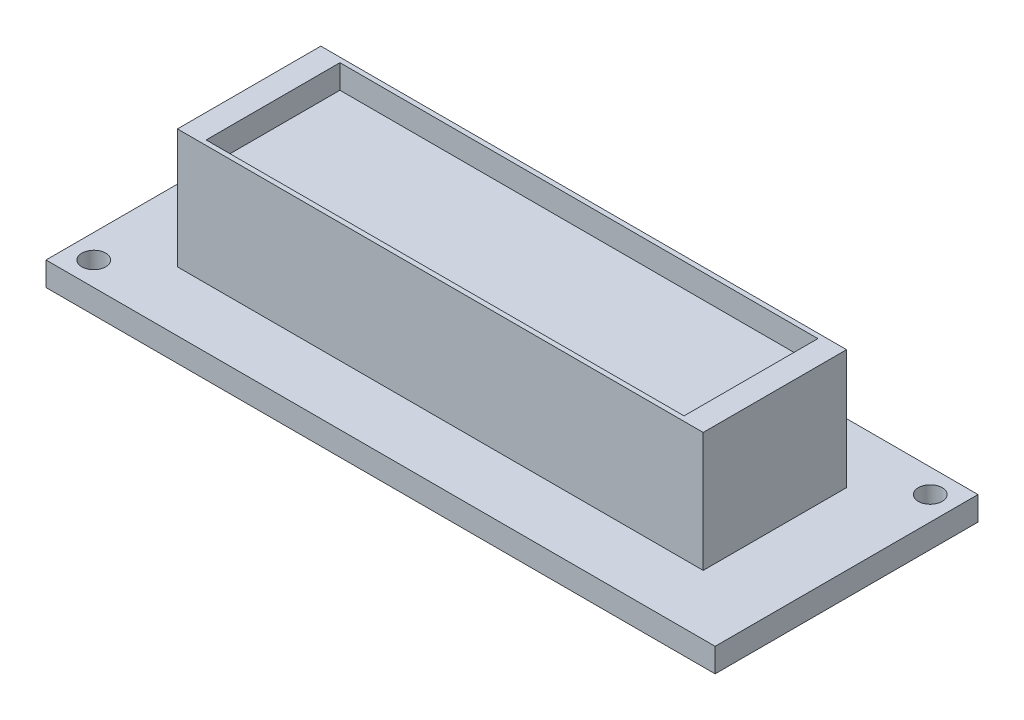
from build123d import *

# Parameters (mm, degrees)
SKETCH1_W           = 100
SKETCH1_H           = 28
BOSS_EXTRUDE1_DEPTH = 1
BOSS_EXTRUDE2_DEPTH = 30
BOSS_EXTRUDE3_DEPTH = 5
SKETCH4_W           = 140
SKETCH4_H           = 55
SKETCH4_W_2         = 120
SKETCH4_H_2         = 35
SKETCH4_W_3         = 110
SKETCH4_H_3         = 30
BOSS_EXTRUDE4_DEPTH = 5
SKETCH5_W           = 100
SKETCH5_H           = 28
BOSS_EXTRUDE5_DEPTH = 25
SKETCH6_R           = 2.5
CUT_EXTRUDE1_DEPTH  = 25


with BuildPart() as part:
    # Sketch1 → Boss-Extrude1 (new body)
    with BuildSketch(Plane(origin=(0, 0, 0), x_dir=(1, 0, 0), z_dir=(0, 1, 0))):
        with Locations((50, 14)):
            Rectangle(SKETCH1_W, SKETCH1_H)
    extrude(amount=BOSS_EXTRUDE1_DEPTH)



with BuildPart() as body_2:
    # Sketch2 → Boss-Extrude2 (new body)
    with BuildSketch(Plane(origin=(0, 1, 0), x_dir=(1, 0, 0), z_dir=(0, 1, 0))):
        Polygon((105, -1), (105, 14), (105, 29), (-5, 29), (-5, -1), align=None)
        Polygon((100, 28), (100, 14), (100, 0), (0, 0), (0, 28), align=None, mode=Mode.SUBTRACT)
    extrude(amount=BOSS_EXTRUDE2_DEPTH)

    # Sketch3 → Boss-Extrude3 (add)
    with BuildSketch(Plane.XZ.offset(-1)):
        Polygon((50, 3.5), (50, 1), (105, 1), (105, -29), (50, -29), (50, -31.5), (110, -31.5), (110, 3.5), align=None)
        Polygon((-5, 1), (50, 1), (50, 3.5), (-10, 3.5), (-10, -31.5), (50, -31.5), (50, -29), (-5, -29), align=None)
    extrude(amount=-BOSS_EXTRUDE3_DEPTH)

    # Sketch4 → Boss-Extrude4 (add)
    # profile 1 of 2: a face of its own
    with BuildSketch(Plane(origin=(0, 6, 0), x_dir=(1, 0, 0), z_dir=(0, 1, 0))):
        with Locations((50, 14)):
            Rectangle(SKETCH4_W, SKETCH4_H)
        with Locations((50, 14)):
            Rectangle(SKETCH4_W_2, SKETCH4_H_2, mode=Mode.SUBTRACT)
    # profile 2 of 2: a face of its own
    with BuildSketch(Plane(origin=(0, 6, 0), x_dir=(1, 0, 0), z_dir=(0, 1, 0))):
        with Locations((50, 14)):
            Rectangle(SKETCH4_W_2, SKETCH4_H_2)
        with Locations((50, 14)):
            Rectangle(SKETCH4_W_3, SKETCH4_H_3, mode=Mode.SUBTRACT)
    extrude(amount=-BOSS_EXTRUDE4_DEPTH)


with BuildPart() as part_1:
    add(part.part)

    add(body_2.part)  # Boss-Extrude5 merges body 2
    # Sketch5 → Boss-Extrude5 (add)
    with BuildSketch(Plane(origin=(0, 1, 0), x_dir=(1, 0, 0), z_dir=(0, 1, 0))):
        with Locations((50, 14)):
            Rectangle(SKETCH5_W, SKETCH5_H)
    extrude(amount=BOSS_EXTRUDE5_DEPTH)

    # Sketch6 → Cut-Extrude1 (cut)
    with BuildSketch(Plane(origin=(0, 6, 0), x_dir=(1, 0, 0), z_dir=(0, 1, 0))):
        with Locations(Location((115, 36.5, 0), (0, 0, 270))):
            Circle(SKETCH6_R)
        with Locations(Location((-15, -8.5, 0), (0, 0, 270))):
            Circle(SKETCH6_R)
    extrude(amount=-CUT_EXTRUDE1_DEPTH, mode=Mode.SUBTRACT)


solid = part_1.part
